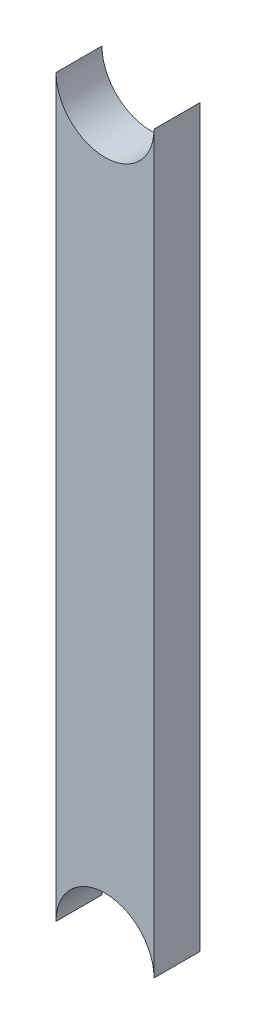
from build123d import *

# Parameters (mm, degrees)
BOSS_EXTRUDE3_DEPTH = 3


with BuildPart() as part:
    # Sketch1 → Boss-Extrude3 (new body)
    with BuildSketch(Plane.XY):
        with BuildLine():
            Line((-3.2, 0), (-3.2, 48))
            ThreePointArc((-3.2, 48), (0, 44.8), (3.2, 48))
            Line((3.2, 48), (3.2, 0))
            ThreePointArc((3.2, 0), (0, 3.2), (-3.2, 0))
        make_face()
    extrude(amount=BOSS_EXTRUDE3_DEPTH)


solid = part.part
